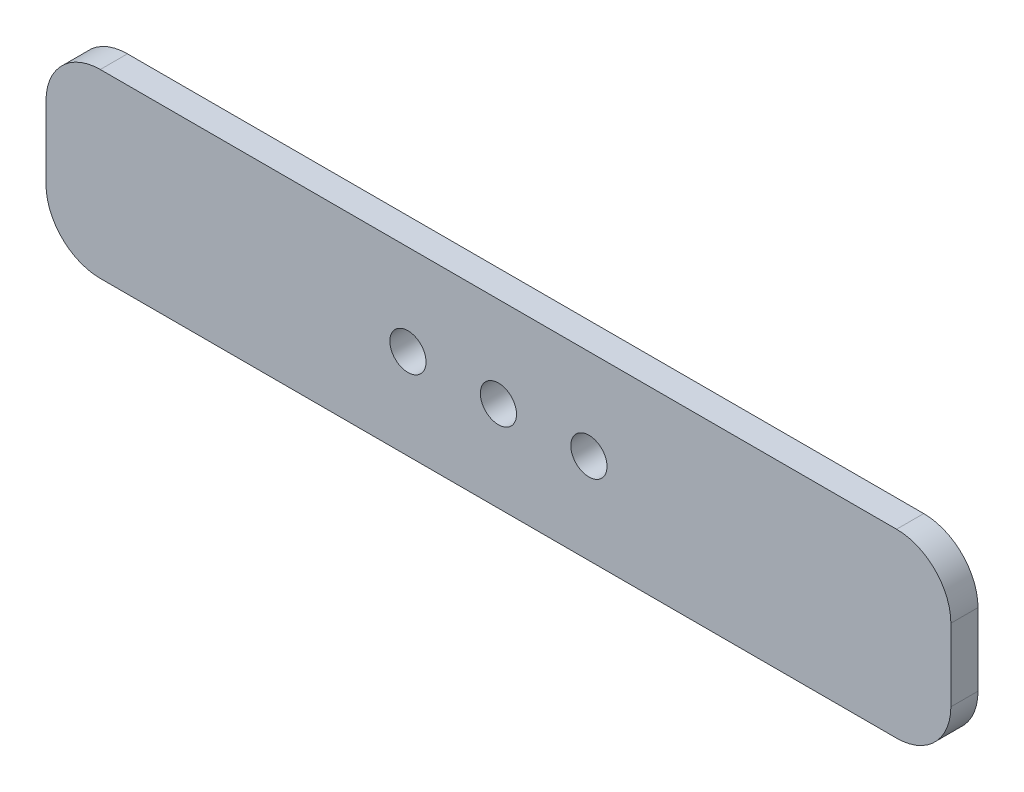
from build123d import *

# Parameters (mm, degrees)
BOSS_EXTRU_1_DEPTH      = 15
ESQUISSE2_R             = 10
ENL_V_MAT_EXTRU_2_DEPTH = 511.122534299
ESQUISSE3_R             = 3
ENL_V_MAT_EXTRU_3_DEPTH = 20


with BuildPart() as part:
    # Esquisse1 → Boss.-Extru.1 (new body)
    with BuildSketch(Plane.XY):
        with BuildLine():
            Line((30, 0), (470, 0))
            ThreePointArc((470, 0), (491.213203436, 8.786796564), (500, 30))
            Line((500, 30), (500, 70))
            ThreePointArc((500, 70), (491.213203436, 91.213203436), (470, 100))
            Line((470, 100), (30, 100))
            ThreePointArc((30, 100), (8.786796564, 91.213203436), (0, 70))
            Line((0, 70), (0, 30))
            ThreePointArc((0, 30), (8.786796564, 8.786796564), (30, 0))
        make_face()
    extrude(amount=BOSS_EXTRU_1_DEPTH)

    # Esquisse2 → Enlèv. mat.-Extru.2 (cut, through all)
    with BuildSketch(Plane.XY.offset(15)):
        with Locations((200, 50)):
            Circle(ESQUISSE2_R)
        with Locations((250, 50)):
            Circle(ESQUISSE2_R)
        with Locations((300, 50)):
            Circle(ESQUISSE2_R)
    extrude(amount=-ENL_V_MAT_EXTRU_2_DEPTH, mode=Mode.SUBTRACT)

    # Esquisse3 → Enlèv. mat.-Extru.3 (cut)
    with BuildSketch(Plane.XZ):
        with Locations(Location((60, 7.5, 0), (0, 0, 270))):
            Circle(ESQUISSE3_R)
        with Locations(Location((440, 7.5, 0), (0, 0, 270))):
            Circle(ESQUISSE3_R)
    extrude(amount=-ENL_V_MAT_EXTRU_3_DEPTH, mode=Mode.SUBTRACT)


solid = part.part
